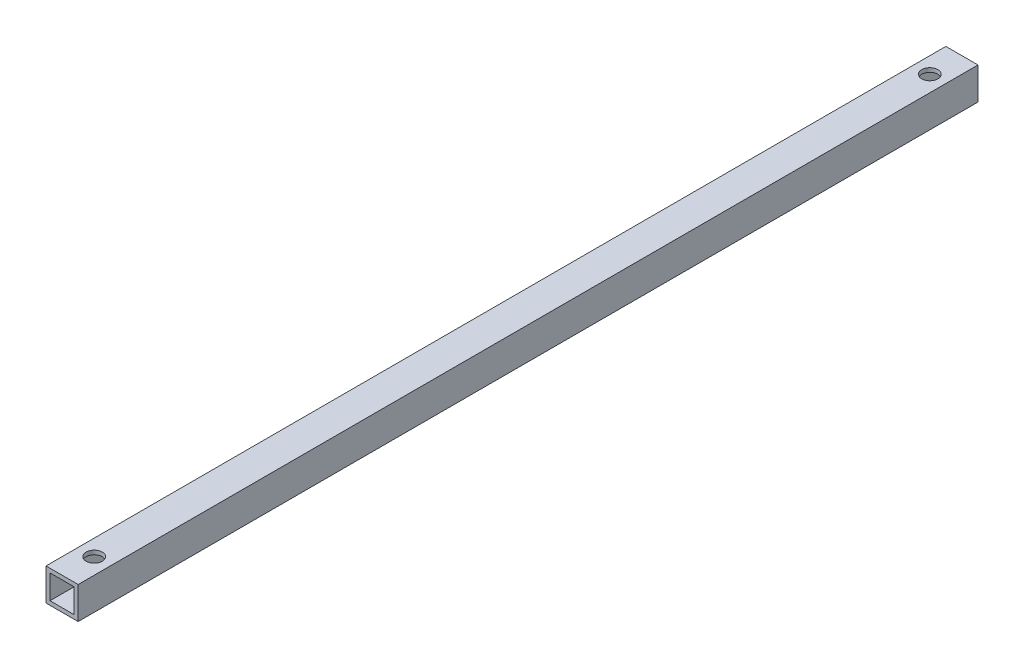
from build123d import *

# Parameters (mm, degrees)
BOSS_EXTRUDE1_DEPTH      = 355.6
BOSS_EXTRUDE1_DEPTH_BACK = 355.6
SKETCH1_W                = 25.4
SKETCH1_H                = 25.4
SKETCH1_W_2              = 19.05
SKETCH1_H_2              = 19.05
SKETCH2_R                = 6.35
CUT_EXTRUDE1_DEPTH       = 495.648289191


with BuildPart() as part:
    # Sketch1 → Boss-Extrude1 (new, two sides: drawn at the far end of the back side and taken through both)
    with BuildSketch(Plane.XY.offset(-BOSS_EXTRUDE1_DEPTH_BACK)):
        with Locations((330.2, 79.375)):
            Rectangle(SKETCH1_W, SKETCH1_H)
        with Locations((330.2, 79.375)):
            Rectangle(SKETCH1_W_2, SKETCH1_H_2, mode=Mode.SUBTRACT)
    extrude(amount=BOSS_EXTRUDE1_DEPTH + BOSS_EXTRUDE1_DEPTH_BACK)

    # Sketch2 → Cut-Extrude1 (cut, through all)
    with BuildSketch(Plane(origin=(0, 92.075, 0), x_dir=(1, 0, 0), z_dir=(0, 1, 0))):
        with Locations(Location((330.2, -330.2, 0), (0, 0, 270))):
            Circle(SKETCH2_R)
        with Locations(Location((330.2, 330.2, 0), (0, 0, 270))):
            Circle(SKETCH2_R)
    extrude(amount=-CUT_EXTRUDE1_DEPTH, mode=Mode.SUBTRACT)


solid = part.part
